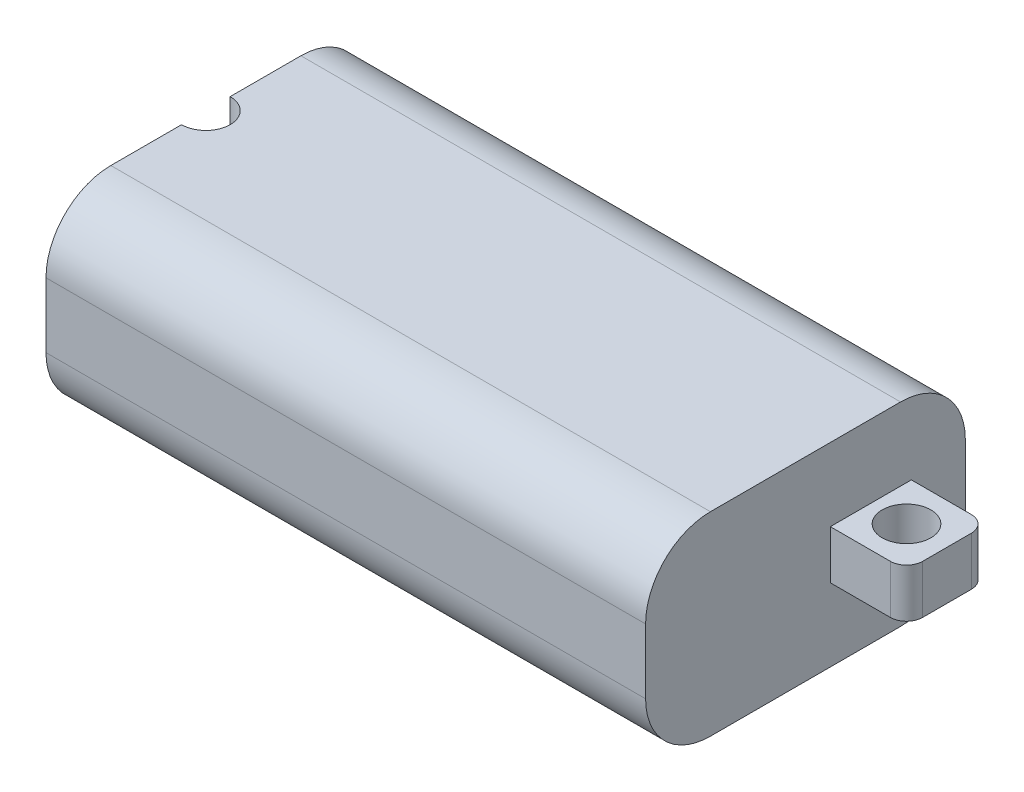
from build123d import *

# Parameters (mm, degrees)
SKETCH_1_W          = 37
SKETCH_1_H          = 19.73
EXTRUDE_1_DEPTH     = 12
SKETCH_2_R          = 1.5
CUT_EXTRUDE_1_DEPTH = 25.157156807
FILLET_2_R          = 4
SKETCH_3_R          = 2.5
CUT_EXTRUDE_2_DEPTH = 30
SKETCH_4_W          = 5
SKETCH_4_H          = 3
EXTRUDE_2_DEPTH     = 4.7
SKETCH_5_R          = 1.5
CUT_EXTRUDE_3_DEPTH = 27.302247528
FILLET_3_R          = 1


with BuildPart() as part:
    # 草图1 → 凸台-拉伸1 (new body)
    with BuildSketch(Plane(origin=(0, 0, 0), x_dir=(1, 0, 0), z_dir=(0, 1, 0))):
        Rectangle(SKETCH_1_W, SKETCH_1_H)
    extrude(amount=EXTRUDE_1_DEPTH)

    # 草图2 → 切除-拉伸1 (cut, through all)
    with BuildSketch(Plane(origin=(0, 12, 0), x_dir=(1, 0, 0), z_dir=(0, 1, 0))):
        with Locations((-18.5, 0)):
            Circle(SKETCH_2_R)
    extrude(amount=-CUT_EXTRUDE_1_DEPTH, mode=Mode.SUBTRACT)

    # 圆角2
    fillet_2_edges = [part.edges().sort_by_distance(p)[0] for p in [
        (0, 12, -9.865),
        (0, 0, -9.865),
        (0, 0, 9.865),
        (0, 12, 9.865),
    ]]
    fillet(fillet_2_edges, radius=FILLET_2_R)

    # 草图3 → 切除-拉伸2 (cut)
    with BuildSketch(Plane.ZY.offset(18.5)):
        with Locations((-4.035, 6)):
            Circle(SKETCH_3_R)
    extrude(amount=-CUT_EXTRUDE_2_DEPTH, mode=Mode.SUBTRACT)

    # 草图4 → 凸台-拉伸2 (add)
    with BuildSketch(Plane(origin=(18.5, 0, 0), x_dir=(0, 0, -1), z_dir=(1, 0, 0))):
        with Locations((4.035, 6)):
            Rectangle(SKETCH_4_W, SKETCH_4_H)
    extrude(amount=EXTRUDE_2_DEPTH)

    # 草图5 → 切除-拉伸3 (cut, through all)
    with BuildSketch(Plane(origin=(0, 7.5, 0), x_dir=(1, 0, 0), z_dir=(0, 1, 0))):
        with Locations(Location((20.7, 4.035, 0), (0, 0, 270))):
            Circle(SKETCH_5_R)
    extrude(amount=-CUT_EXTRUDE_3_DEPTH, mode=Mode.SUBTRACT)

    # 圆角3
    fillet_3_edges = [part.edges().sort_by_distance(p)[0] for p in [
        (23.2, 6, -6.535),
        (23.2, 6, -1.535),
    ]]
    fillet(fillet_3_edges, radius=FILLET_3_R)


solid = part.part
